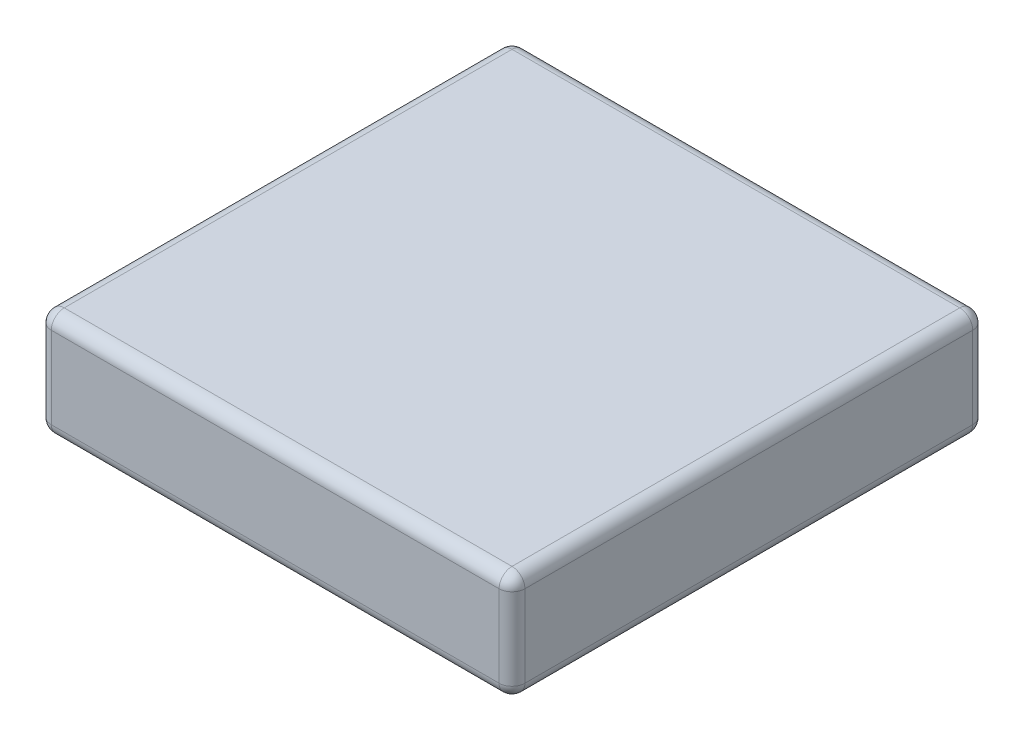
from build123d import *

# Parameters (mm, degrees)
SKETCH1_W           = 110
SKETCH1_H           = 110
BOSS_EXTRUDE1_DEPTH = 25
FILLET1_R           = 3


with BuildPart() as part:
    # Sketch1 → Boss-Extrude1 (new body)
    with BuildSketch(Plane(origin=(0, 0, 0), x_dir=(1, 0, 0), z_dir=(0, 1, 0))):
        Rectangle(SKETCH1_W, SKETCH1_H)
    extrude(amount=BOSS_EXTRUDE1_DEPTH)

    # Fillet1
    fillet1_edges = [part.edges().sort_by_distance(p)[0] for p in [
        (-55, 25, 0),
        (0, 25, 55),
        (55, 25, 0),
        (0, 0, 55),
        (-55, 0, 0),
        (0, 0, -55),
        (55, 0, 0),
        (55, 12.5, 55),
        (-55, 12.5, 55),
        (-55, 12.5, -55),
        (55, 12.5, -55),
        (0, 25, -55),
    ]]
    fillet(fillet1_edges, radius=FILLET1_R)


solid = part.part
